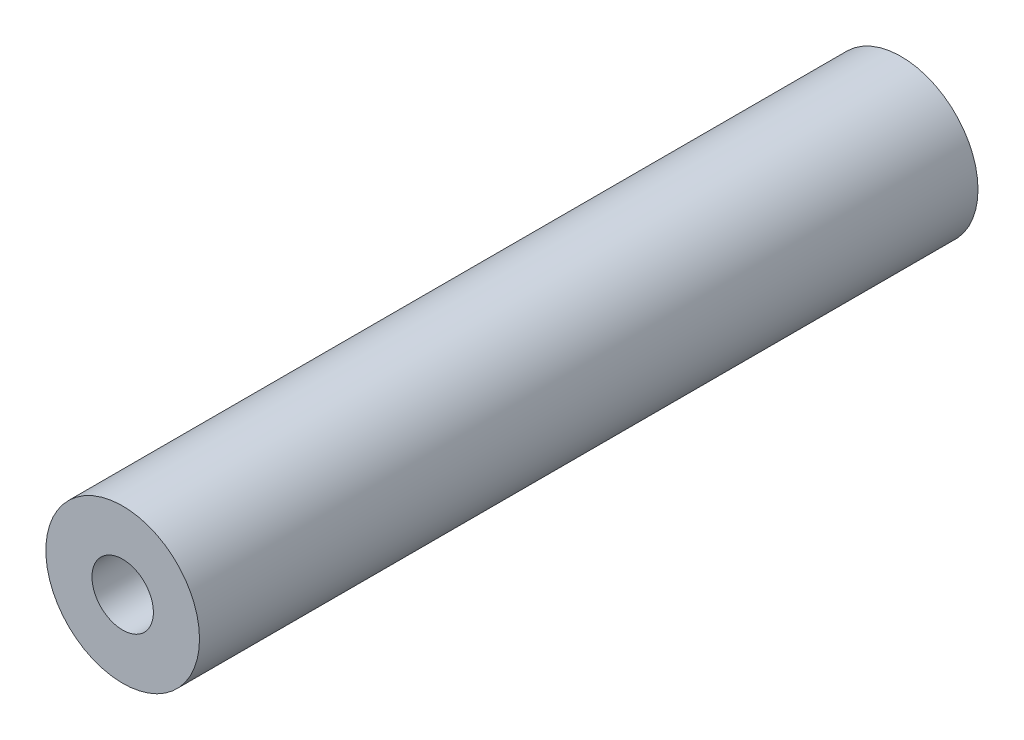
from build123d import *

# Parameters (mm, degrees)
SZKIC1_R                    = 15
DODANIE_WYCI_GNI_CIE1_DEPTH = 152
SZKIC2_R                    = 6
WYTNIJ_WYCI_GNI_CIE1_DEPTH  = 55
WYTNIJ_WYCI_GNI_CIE2_START  = -55
SZKIC3_R                    = 6
WYTNIJ_WYCI_GNI_CIE2_DEPTH  = 55


with BuildPart() as part:
    # Szkic1 → Dodanie-wyciągnięcie1 (new body)
    with BuildSketch(Plane.XY):
        Circle(SZKIC1_R)
    extrude(amount=DODANIE_WYCI_GNI_CIE1_DEPTH)

    # Szkic2 → Wytnij-wyciągnięcie1 (cut)
    with BuildSketch(Plane(origin=(0, 0, 0), x_dir=(-1, 0, 0), z_dir=(0, 0, -1))):
        Circle(SZKIC2_R)
    extrude(amount=-WYTNIJ_WYCI_GNI_CIE1_DEPTH, mode=Mode.SUBTRACT)

    # Szkic3 → Wytnij-wyciągnięcie2 (cut)
    with BuildSketch(Plane.XY.offset(152).offset(WYTNIJ_WYCI_GNI_CIE2_START)):
        with Locations(Location((0, 0, 0), (0, 0, 180))):
            Circle(SZKIC3_R)
    extrude(amount=WYTNIJ_WYCI_GNI_CIE2_DEPTH, mode=Mode.SUBTRACT)


solid = part.part
